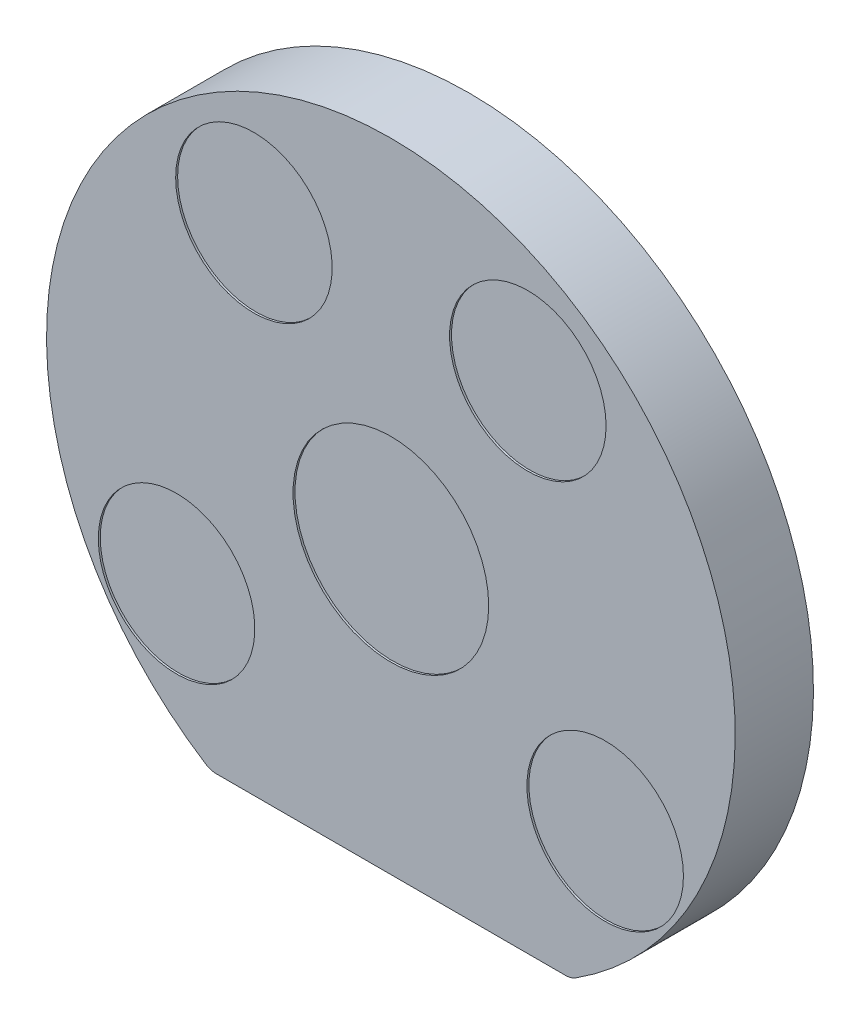
from build123d import *

# Parameters (mm, degrees)
BOSS_EXTRUDE1_DEPTH = 20
CUT_EXTRUDE1_DEPTH  = 17
SKETCH4_R           = 25
SKETCH4_R_2         = 20
CUT_EXTRUDE2_DEPTH  = 0.5
FILLET1_R           = 10
FILLET2_R           = 5


with BuildPart() as part:
    # Sketch2 → Boss-Extrude1 (new body)
    with BuildSketch(Plane.XY):
        with BuildLine():
            ThreePointArc((88, 0), (-42.971685161, 76.794754212), (-46.032597146, -75))
            Line((-46.032597146, -75), (46.032597146, -75))
            ThreePointArc((46.032597146, -75), (76.794754212, -42.971685161), (88, 0))
        make_face()
    extrude(amount=-BOSS_EXTRUDE1_DEPTH)

    # Sketch3 → Cut-Extrude1 (cut)
    with BuildSketch(Plane(origin=(0, 0, -20), x_dir=(-1, 0, 0), z_dir=(0, 0, -1))):
        with BuildLine():
            Line((-43.116122275, -65), (43.116122275, -65))
            ThreePointArc((43.116122275, -65), (0, 78), (-43.116122275, -65))
        make_face()
    extrude(amount=-CUT_EXTRUDE1_DEPTH, mode=Mode.SUBTRACT)

    # Sketch4 → Cut-Extrude2 (cut)
    with BuildSketch(Plane.XY):
        with Locations((0, -3)):
            Circle(SKETCH4_R)
        with Locations(Location((-54.77, -38, 0), (0, 0, 180))):
            Circle(SKETCH4_R_2)
        with Locations((35, 51.77)):
            Circle(SKETCH4_R_2)
        with Locations((54.77, -38)):
            Circle(SKETCH4_R_2)
        with Locations(Location((-35, 51.77, 0), (0, 0, 180))):
            Circle(SKETCH4_R_2)
    extrude(amount=-CUT_EXTRUDE2_DEPTH, mode=Mode.SUBTRACT)

    # Fillet1
    fillet1_edges = [part.edges().sort_by_distance(p)[0] for p in [
        (43.116122275, -65, -11.5),
        (-43.116122275, -65, -11.5),
    ]]
    fillet(fillet1_edges, radius=FILLET1_R)

    # Fillet2
    fillet2_edges = [part.edges().sort_by_distance(p)[0] for p in [
        (-46.032597146, -75, -10),
        (46.032597146, -75, -10),
    ]]
    fillet(fillet2_edges, radius=FILLET2_R)


solid = part.part
